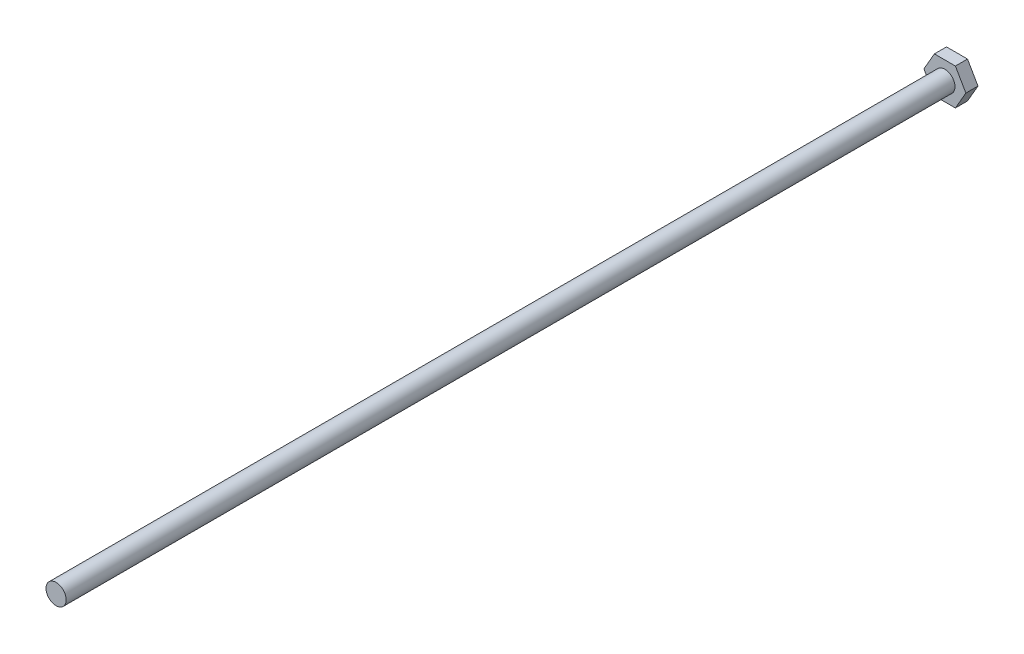
from build123d import *

# Parameters (mm, degrees)
ESBO_O1_R       = 2.5
EXTRUS_O1_DEPTH = 220
EXTRUS_O2_DEPTH = 3


with BuildPart() as part:
    # Esboço1 → Extrusão1 (new body)
    with BuildSketch(Plane.XY):
        Circle(ESBO_O1_R)
    extrude(amount=EXTRUS_O1_DEPTH)

    # Esboço2 → Extrusão2 (add)
    with BuildSketch(Plane(origin=(0, 0, 0), x_dir=(-1, 0, 0), z_dir=(0, 0, -1))):
        Polygon((5.196152423, 0), (2.598076211, 4.5), (-2.598076211, 4.5), (-5.196152423, 0), (-2.598076211, -4.5), (2.598076211, -4.5), align=None)
    extrude(amount=EXTRUS_O2_DEPTH)


solid = part.part
